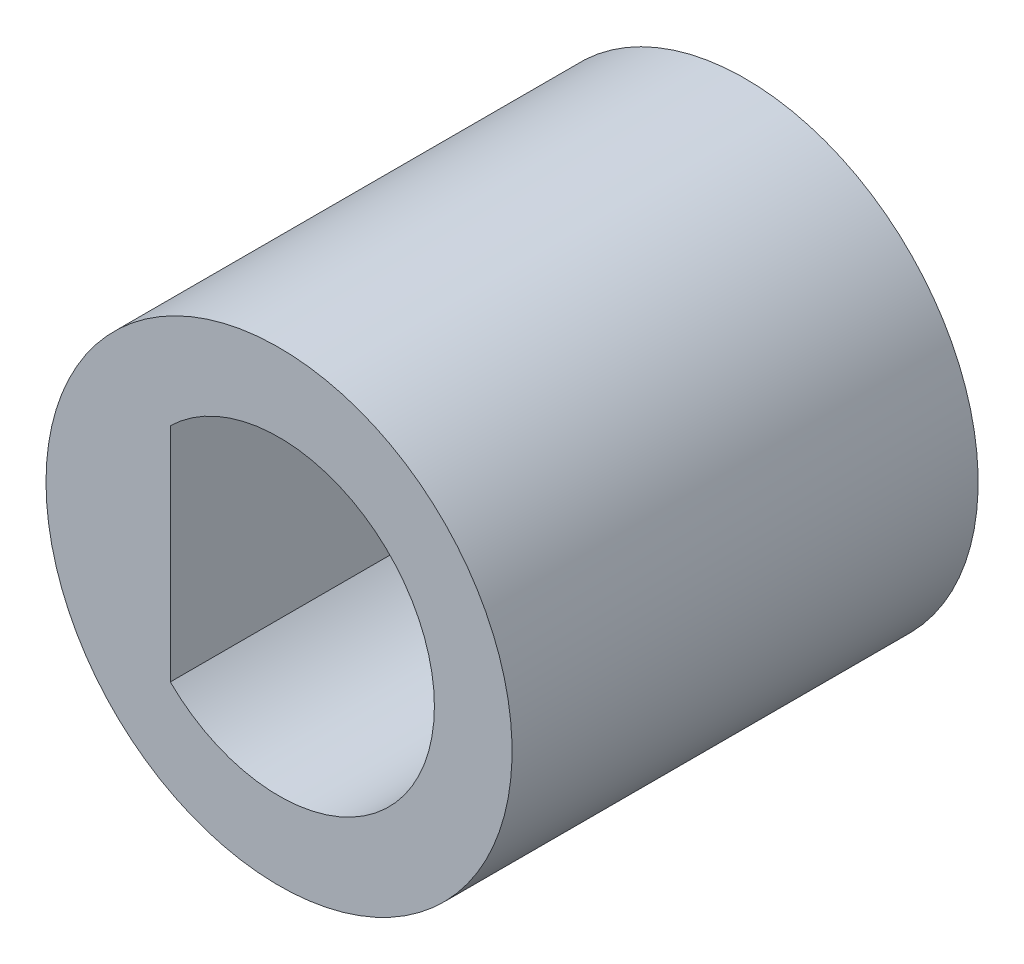
from build123d import *

# Parameters (mm, degrees)
SKETCH1_R           = 4.7625
BOSS_EXTRUDE1_DEPTH = 9.525


with BuildPart() as part:
    # Sketch1 → Boss-Extrude1 (new body)
    with BuildSketch(Plane.XY):
        with Locations(Location((0, 0, 0), (0, 0, 180))):
            Circle(SKETCH1_R)
        with BuildLine():
            Line((-2.2225, -2.267403526), (-2.2225, 2.267403526))
            ThreePointArc((-2.2225, 2.267403526), (3.175, 0), (-2.2225, -2.267403526))
        make_face(mode=Mode.SUBTRACT)
    extrude(amount=BOSS_EXTRUDE1_DEPTH)


solid = part.part
